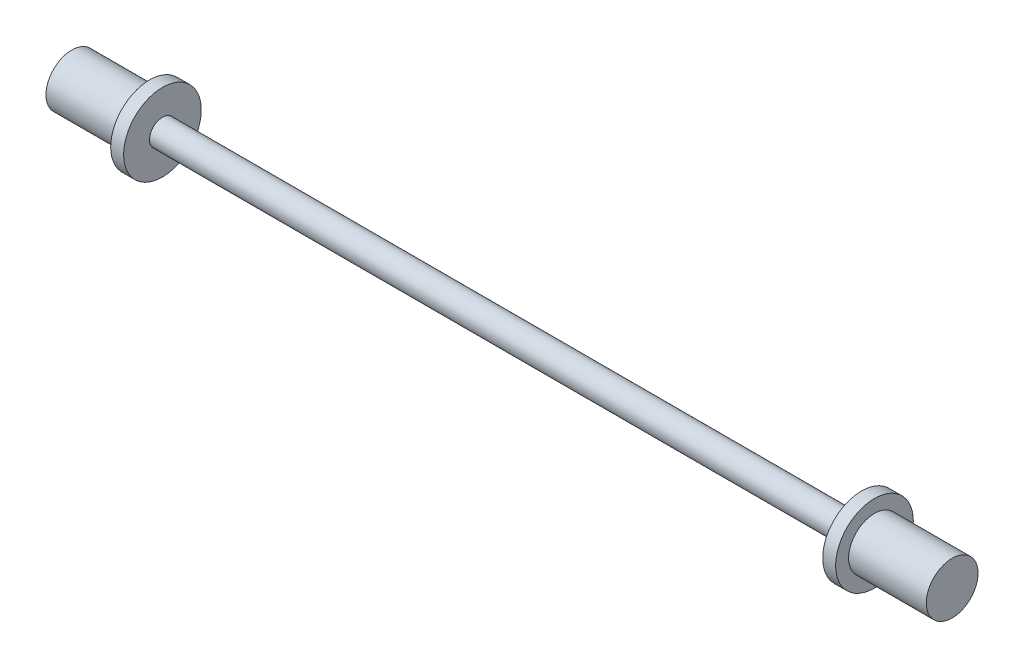
from build123d import *

# Parameters (mm, degrees)
BOSS_EXTRUDE1_DEPTH      = 171.45
BOSS_EXTRUDE1_DEPTH_BACK = 171.45
SKETCH2_R                = 6.35
SKETCH3_R                = 19.05
BOSS_EXTRUDE2_DEPTH      = 6.35
BOSS_EXTRUDE4_START      = 6.35
SKETCH7_R                = 19.05
BOSS_EXTRUDE4_DEPTH      = 6.35
SKETCH9_R                = 12.7
BOSS_EXTRUDE6_DEPTH      = 38.1
BOSS_EXTRUDE7_START      = 38.1
SKETCH10_R               = 12.7
BOSS_EXTRUDE7_DEPTH      = 38.1


with BuildPart() as part:
    # Sketch2 → Boss-Extrude1 (new, two sides: drawn at the far end of the back side and taken through both)
    with BuildSketch(Plane(origin=(0, 0, 0), x_dir=(0, 0, -1), z_dir=(1, 0, 0)).offset(-BOSS_EXTRUDE1_DEPTH_BACK)):
        Circle(SKETCH2_R)
    extrude(amount=BOSS_EXTRUDE1_DEPTH + BOSS_EXTRUDE1_DEPTH_BACK)

    # Sketch3 → Boss-Extrude2 (add)
    with BuildSketch(Plane(origin=(171.45, 0, 0), x_dir=(0, 0, -1), z_dir=(1, 0, 0))):
        Circle(SKETCH3_R)
    extrude(amount=BOSS_EXTRUDE2_DEPTH)

    # Sketch7 → Boss-Extrude4 (add)
    with BuildSketch(Plane.ZY.offset(171.45).offset(BOSS_EXTRUDE4_START)):
        Circle(SKETCH7_R)
    extrude(amount=-BOSS_EXTRUDE4_DEPTH)

    # Sketch9 → Boss-Extrude6 (add)
    with BuildSketch(Plane.ZY.offset(177.8)):
        Circle(SKETCH9_R)
    extrude(amount=BOSS_EXTRUDE6_DEPTH)

    # Sketch10 → Boss-Extrude7 (add)
    with BuildSketch(Plane(origin=(177.8, 0, 0), x_dir=(0, 0, -1), z_dir=(1, 0, 0)).offset(BOSS_EXTRUDE7_START)):
        Circle(SKETCH10_R)
    extrude(amount=-BOSS_EXTRUDE7_DEPTH)


solid = part.part
